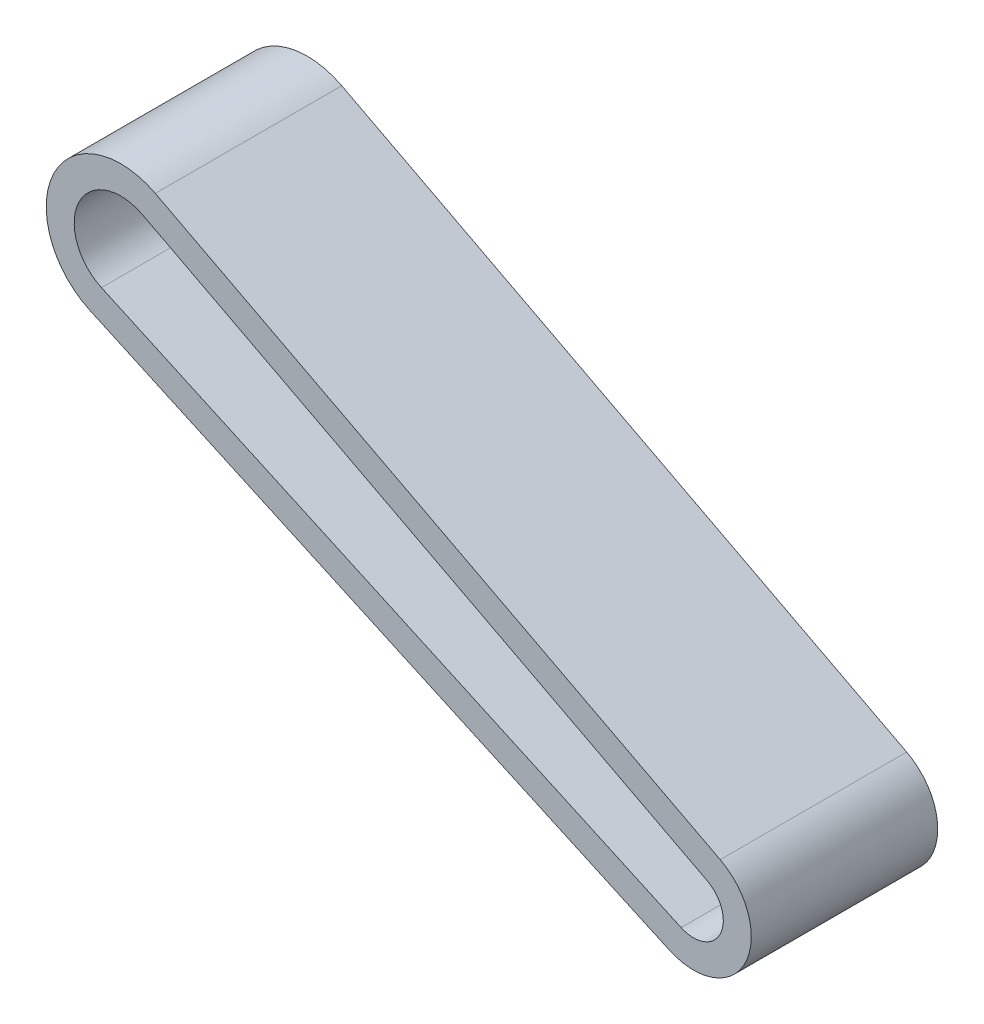
from build123d import *

# Parameters (mm, degrees)
EXTRUDE_THIN1_DEPTH = 5


with BuildPart() as part:
    # Sketch2 → Extrude-Thin1 (new, symmetric)
    with BuildSketch(Plane.XY):
        with BuildLine():
            Line((351.269649849, 18.860704355), (382.360077524, 4.679545875))
            ThreePointArc((382.360077524, 4.679545875), (386.432166055, 6.139705228), (385.079723978, 10.248825665))
            Line((385.079723978, 10.248825665), (354.778871081, 26.046871826))
            ThreePointArc((354.778871081, 26.046871826), (349.335298217, 24.255219061), (351.269649849, 18.860704355))
        make_face()
        with BuildLine():
            Line((351.892141628, 20.225440222), (382.982569302, 6.044281742))
            ThreePointArc((382.982569302, 6.044281742), (385.084292415, 6.797912376), (384.386257794, 8.91874873))
            Line((384.386257794, 8.91874873), (354.085404897, 24.716794891))
            ThreePointArc((354.085404897, 24.716794891), (350.683171858, 23.597011913), (351.892141628, 20.225440222))
        make_face(mode=Mode.SUBTRACT)
    extrude(amount=EXTRUDE_THIN1_DEPTH, both=True)


solid = part.part
